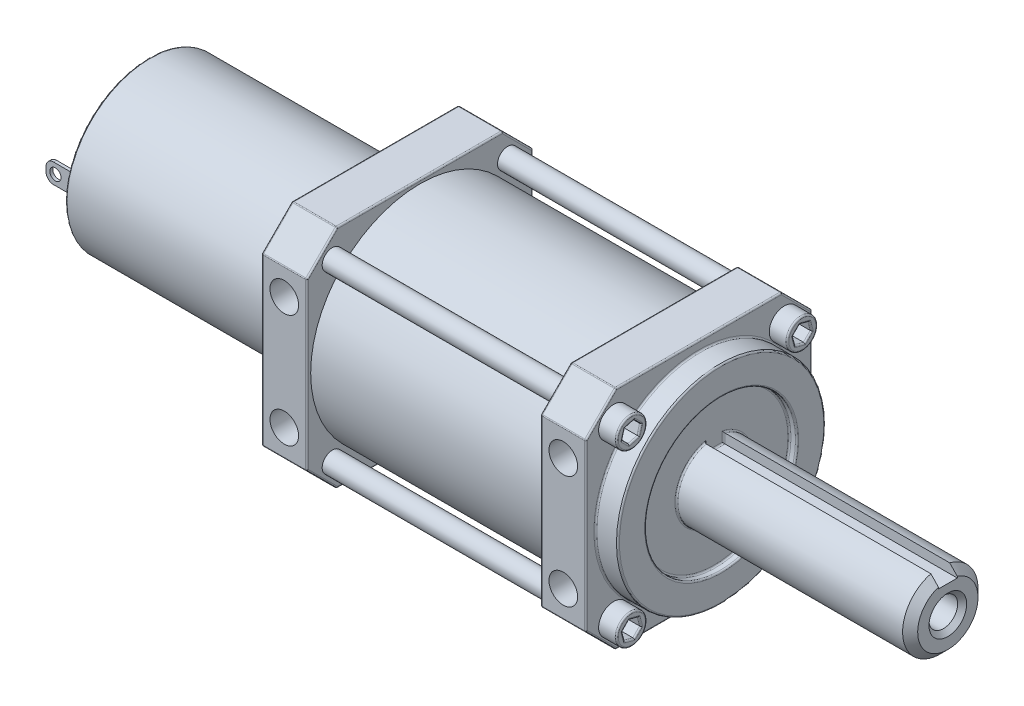
from build123d import *

# Parameters (mm, degrees)
SKETCH1_W            = 38.1
SKETCH1_H            = 38.1
BOSS_EXTRUDE1_DEPTH  = 3.81
CHAMFER1_SIZE        = 5.08
SKETCH2_R            = 17.4625
BOSS_EXTRUDE2_DEPTH  = 3.81
SKETCH3_R            = 12.7
CUT_EXTRUDE1_DEPTH   = 1.27
BOSS_EXTRUDE3_DEPTH  = 39.37
SKETCH5_R            = 2.413
CUT_EXTRUDE2_DEPTH   = 12.7
SKETCH6_R            = 18.415
BOSS_EXTRUDE4_DEPTH  = 39.37
SKETCH7_W            = 38.1
SKETCH7_H            = 38.1
BOSS_EXTRUDE5_DEPTH  = 7.62
CHAMFER2_SIZE        = 5.08
SKETCH8_R            = 1.7145
BOSS_EXTRUDE6_DEPTH  = 39.37
SKETCH10_R           = 2.54
BOSS_EXTRUDE9_DEPTH  = 3.048
SKETCH11_R           = 13.97
BOSS_EXTRUDE10_DEPTH = 38.1
SKETCH12_R           = 5.08
BOSS_EXTRUDE11_DEPTH = 3.048
FILLET2_R            = 1.27
SKETCH14_W           = 0.508
SKETCH14_H           = 3.302
BOSS_EXTRUDE12_DEPTH = 6.35
SKETCH15_R           = 0.9525
CUT_EXTRUDE3_DEPTH   = 102.655229988
FILLET12_R           = 0.254
FILLET13_R           = 1.27
CHAMFER3_SIZE        = 0.762
CHAMFER4_SIZE        = 1.27
SKETCH16_R           = 2.413
CUT_EXTRUDE4_DEPTH   = 10.16


with BuildPart() as part:
    # Sketch1 → Boss-Extrude1 (new, symmetric)
    with BuildSketch(Plane(origin=(0, 0, 0), x_dir=(0, 0, -1), z_dir=(1, 0, 0))):
        Rectangle(SKETCH1_W, SKETCH1_H)
    extrude(amount=BOSS_EXTRUDE1_DEPTH, both=True)

    # Chamfer1
    chamfer1_edges = [part.edges().sort_by_distance(p)[0] for p in [
        (0, -19.05, -19.05),
        (0, -19.05, 19.05),
        (0, 19.05, 19.05),
        (0, 19.05, -19.05),
    ]]
    chamfer(chamfer1_edges, length=CHAMFER1_SIZE)

    # Sketch2 → Boss-Extrude2 (add)
    with BuildSketch(Plane(origin=(3.81, 0, 0), x_dir=(0, 0, -1), z_dir=(1, 0, 0))):
        with Locations(Location((0, 0, 0), (0, 0, 180))):
            Circle(SKETCH2_R)
    extrude(amount=BOSS_EXTRUDE2_DEPTH)

    # Sketch3 → Cut-Extrude1 (cut)
    with BuildSketch(Plane(origin=(7.62, 0, 0), x_dir=(0, 0, -1), z_dir=(1, 0, 0))):
        Circle(SKETCH3_R)
    extrude(amount=-CUT_EXTRUDE1_DEPTH, mode=Mode.SUBTRACT)

    # Sketch4 → Boss-Extrude3 (add)
    with BuildSketch(Plane(origin=(6.35, 0, 0), x_dir=(0, 0, -1), z_dir=(1, 0, 0))):
        with BuildLine():
            Line((1.5875, 6.148361062), (1.5875, 4.560861062))
            Line((1.5875, 4.560861062), (-1.5875, 4.560861062))
            Line((-1.5875, 4.560861062), (-1.5875, 6.148361062))
            ThreePointArc((-1.5875, 6.148361062), (0, -6.35), (1.5875, 6.148361062))
        make_face()
    extrude(amount=BOSS_EXTRUDE3_DEPTH)

    # Sketch5 → Cut-Extrude2 (cut)
    with BuildSketch(Plane(origin=(45.72, 0, 0), x_dir=(0, 0, -1), z_dir=(1, 0, 0))):
        Circle(SKETCH5_R)
    extrude(amount=-CUT_EXTRUDE2_DEPTH, mode=Mode.SUBTRACT)

    # Sketch6 → Boss-Extrude4 (add)
    with BuildSketch(Plane.ZY.offset(3.81)):
        with Locations(Location((0, 0, 0), (0, 0, 180))):
            Circle(SKETCH6_R)
    extrude(amount=BOSS_EXTRUDE4_DEPTH)

    # Sketch7 → Boss-Extrude5 (add)
    with BuildSketch(Plane.ZY.offset(43.18)):
        Rectangle(SKETCH7_W, SKETCH7_H)
    extrude(amount=BOSS_EXTRUDE5_DEPTH)

    # Chamfer2
    chamfer2_edges = [part.edges().sort_by_distance(p)[0] for p in [
        (-46.99, -19.05, 19.05),
        (-46.99, 19.05, 19.05),
        (-46.99, 19.05, -19.05),
        (-46.99, -19.05, -19.05),
    ]]
    chamfer(chamfer2_edges, length=CHAMFER2_SIZE)

    # Sketch8 → Boss-Extrude6 (add)
    with BuildSketch(Plane.ZY.offset(3.81)):
        with Locations(Location((-14.765685688, 14.765685688, 0), (0, 0, 180))):
            Circle(SKETCH8_R)
        with Locations(Location((14.765685688, 14.765685688, 0), (0, 0, 180))):
            Circle(SKETCH8_R)
        with Locations(Location((14.765685688, -14.765685688, 0), (0, 0, 180))):
            Circle(SKETCH8_R)
        with Locations(Location((-14.765685688, -14.765685688, 0), (0, 0, 180))):
            Circle(SKETCH8_R)
    extrude(amount=BOSS_EXTRUDE6_DEPTH)

    # Sketch10 → Boss-Extrude9 (add)
    # profile 1 of 4: a face of its own
    with BuildSketch(Plane(origin=(3.81, 0, 0), x_dir=(0, 0, -1), z_dir=(1, 0, 0))):
        with Locations(Location((14.368409794, 14.368409794, 0), (0, 0, 180))):
            Circle(SKETCH10_R)
        Polygon((15.509055517, 15.509055517), (13.950904482, 15.926560829), (12.810258759, 14.785915105), (13.22776407, 13.22776407), (14.785915105, 12.810258759), (15.926560829, 13.950904482), align=None, mode=Mode.SUBTRACT)
    # profile 2 of 4: a face of its own
    with BuildSketch(Plane(origin=(3.81, 0, 0), x_dir=(0, 0, -1), z_dir=(1, 0, 0))):
        with Locations(Location((14.368409794, -14.368409794, 0), (0, 0, 180))):
            Circle(SKETCH10_R)
        Polygon((12.810258759, -14.785915105), (13.950904482, -15.926560829), (15.509055517, -15.509055517), (15.926560829, -13.950904482), (14.785915105, -12.810258759), (13.22776407, -13.22776407), align=None, mode=Mode.SUBTRACT)
    # profile 3 of 4: a face of its own
    with BuildSketch(Plane(origin=(3.81, 0, 0), x_dir=(0, 0, -1), z_dir=(1, 0, 0))):
        with Locations(Location((-14.368409794, -14.368409794, 0), (0, 0, 180))):
            Circle(SKETCH10_R)
        Polygon((-14.785915105, -12.810258759), (-15.926560829, -13.950904482), (-15.509055517, -15.509055517), (-13.950904482, -15.926560829), (-12.810258759, -14.785915105), (-13.22776407, -13.22776407), align=None, mode=Mode.SUBTRACT)
    # profile 4 of 4: a face of its own
    with BuildSketch(Plane(origin=(3.81, 0, 0), x_dir=(0, 0, -1), z_dir=(1, 0, 0))):
        with Locations(Location((-14.368409794, 14.368409794, 0), (0, 0, 180))):
            Circle(SKETCH10_R)
        Polygon((-12.810258759, 14.785915105), (-13.950904482, 15.926560829), (-15.509055517, 15.509055517), (-15.926560829, 13.950904482), (-14.785915105, 12.810258759), (-13.22776407, 13.22776407), align=None, mode=Mode.SUBTRACT)
    extrude(amount=BOSS_EXTRUDE9_DEPTH)

    # Sketch11 → Boss-Extrude10 (add)
    with BuildSketch(Plane.ZY.offset(50.8)):
        with Locations(Location((0, 0, 0), (0, 0, 180))):
            Circle(SKETCH11_R)
    extrude(amount=BOSS_EXTRUDE10_DEPTH)

    # Sketch12 → Boss-Extrude11 (add)
    with BuildSketch(Plane.ZY.offset(88.9)):
        with Locations(Location((0, 0, 0), (0, 0, 180))):
            Circle(SKETCH12_R)
    extrude(amount=BOSS_EXTRUDE11_DEPTH)

    # Fillet2
    fillet2_edges = [part.edges().sort_by_distance(p)[0] for p in [
        (-91.948, 0, 5.08),
    ]]
    fillet(fillet2_edges, radius=FILLET2_R)

    # Sketch14 → Boss-Extrude12 (add)
    with BuildSketch(Plane.ZY.offset(88.9)):
        with Locations((10.668, 0)):
            Rectangle(SKETCH14_W, SKETCH14_H)
        with Locations((-10.668, 0)):
            Rectangle(SKETCH14_W, SKETCH14_H)
    extrude(amount=BOSS_EXTRUDE12_DEPTH)

    # Sketch15 → Cut-Extrude3 (cut, through all)
    with BuildSketch(Plane(origin=(0, 0, -10.922), x_dir=(-1, 0, 0), z_dir=(0, 0, -1))):
        with Locations(Location((93.6625, 0, 0), (0, 0, 90))):
            Circle(SKETCH15_R)
    extrude(amount=-CUT_EXTRUDE3_DEPTH, mode=Mode.SUBTRACT)

    # Fillet12
    fillet12_edges = [part.edges().sort_by_distance(p)[0] for p in [
        (6.858, 14.368409794, -16.908409794),
        (6.858, 14.72998, -15.717808173),
        (6.858, 15.717808173, -14.72998),
        (6.858, 15.356237967, -13.38058162),
        (6.858, 14.006839588, -13.019011414),
        (6.858, 13.019011414, -14.006839588),
        (6.858, 13.38058162, -15.356237967),
        (-3.81, -19.05, 0),
        (3.81, -19.05, 0),
        (6.858, -14.368409794, -16.908409794),
        (6.858, -15.717808173, -14.72998),
        (6.858, -14.72998, -15.717808173),
        (0, -19.05, -13.97),
        (6.858, -13.38058162, -15.356237967),
        (6.858, -13.019011414, -14.006839588),
        (6.858, -14.006839588, -13.019011414),
        (6.858, -15.356237967, -13.38058162),
        (0, -19.05, 13.97),
        (-3.81, 0, -19.05),
        (6.858, -14.368409794, 11.828409794),
        (-3.81, 0, 19.05),
        (6.858, -14.72998, 15.717808173),
        (6.858, -15.717808173, 14.72998),
        (6.858, -15.356237967, 13.38058162),
        (6.858, -14.006839588, 13.019011414),
        (6.858, -13.019011414, 14.006839588),
        (6.858, -13.38058162, 15.356237967),
        (-3.81, 19.05, 0),
        (-3.81, -16.51, -16.51),
        (-3.81, 16.51, -16.51),
        (6.858, 14.368409794, 11.828409794),
        (6.858, 15.717808173, 14.72998),
        (6.858, 14.72998, 15.717808173),
        (6.858, 13.38058162, 15.356237967),
        (6.858, 13.019011414, 14.006839588),
        (6.858, 14.006839588, 13.019011414),
        (6.858, 15.356237967, 13.38058162),
        (-3.81, 16.51, 16.51),
        (-3.81, -16.51, 16.51),
        (3.81, 0, 19.05),
        (0, 13.97, 19.05),
        (-88.9, 0, 13.97),
        (0, -13.97, 19.05),
        (-88.9, 0, 5.08),
        (3.81, 0, -19.05),
        (-88.9, 0, 10.922),
        (-88.9, 1.651, 10.668),
        (-88.9, 0, 10.414),
        (-88.9, -1.651, 10.668),
        (3.81, 19.05, 0),
        (3.81, -16.51, -16.51),
        (-88.9, 0, -10.414),
        (-88.9, 1.651, -10.668),
        (-88.9, 0, -10.922),
        (3.81, 16.51, -16.51),
        (-88.9, -1.651, -10.668),
        (3.81, 16.51, 16.51),
        (3.81, -16.51, 16.51),
        (0, 19.05, -13.97),
        (0, 19.05, 13.97),
        (0, -13.97, -19.05),
        (0, 13.97, -19.05),
        (3.81, 0, -17.4625),
        (7.62, 0, -17.4625),
        (6.35, 0, 12.7),
        (7.62, 0, 12.7),
        (6.35, 4.560861062, 0),
        (6.35, 5.354611062, 1.5875),
        (6.35, -6.35, 0),
        (6.35, 5.354611062, -1.5875),
        (-43.18, 0, 19.05),
        (-50.8, 0, 19.05),
        (-46.99, 13.97, 19.05),
        (-46.99, -13.97, 19.05),
        (-43.18, -19.05, 0),
        (-43.18, 0, -19.05),
        (-43.18, 19.05, 0),
        (-43.18, 16.51, -16.51),
        (-43.18, 16.51, 16.51),
        (-43.18, -16.51, -16.51),
        (-43.18, -16.51, 16.51),
        (-50.8, -19.05, 0),
        (-46.99, -19.05, -13.97),
        (-46.99, -19.05, 13.97),
        (-50.8, 19.05, 0),
        (-50.8, 0, -19.05),
        (-50.8, 16.51, -16.51),
        (-50.8, 16.51, 16.51),
        (-50.8, -16.51, -16.51),
        (-50.8, -16.51, 16.51),
        (-46.99, 13.97, -19.05),
        (-46.99, -13.97, -19.05),
        (-46.99, 19.05, -13.97),
        (-46.99, 19.05, 13.97),
    ]]
    fillet(fillet12_edges, radius=FILLET12_R)

    # Fillet13
    fillet13_edges = [part.edges().sort_by_distance(p)[0] for p in [
        (-95.25, 1.651, 10.668),
        (-95.25, -1.651, 10.668),
        (-95.25, 1.651, -10.668),
        (-95.25, -1.651, -10.668),
    ]]
    fillet(fillet13_edges, radius=FILLET13_R)

    # Chamfer3
    chamfer3_edges = [part.edges().sort_by_distance(p)[0] for p in [
        (45.72, 0, 2.413),
    ]]
    chamfer(chamfer3_edges, length=CHAMFER3_SIZE)

    # Chamfer4
    chamfer4_edges = [part.edges().sort_by_distance(p)[0] for p in [
        (45.72, -6.35, 0),
    ]]
    chamfer(chamfer4_edges, length=CHAMFER4_SIZE)

    # Sketch16 → Cut-Extrude4 (cut)
    with BuildSketch(Plane(origin=(0, 0, -19.05), x_dir=(-1, 0, 0), z_dir=(0, 0, -1))):
        with Locations((46.99, -9.525)):
            Circle(SKETCH16_R)
        with Locations(Location((46.99, 9.525, 0), (0, 0, 180))):
            Circle(SKETCH16_R)
        with Locations(Location((0, -9.525, 0), (0, 0, 180))):
            Circle(SKETCH16_R)
        with Locations((0, 9.525)):
            Circle(SKETCH16_R)
    cut_extrude4 = extrude(amount=-CUT_EXTRUDE4_DEPTH, mode=Mode.SUBTRACT)

    # Mirror1: Cut-Extrude4 across plane
    add(cut_extrude4.mirror(Plane.XY), mode=Mode.SUBTRACT)


solid = part.part
